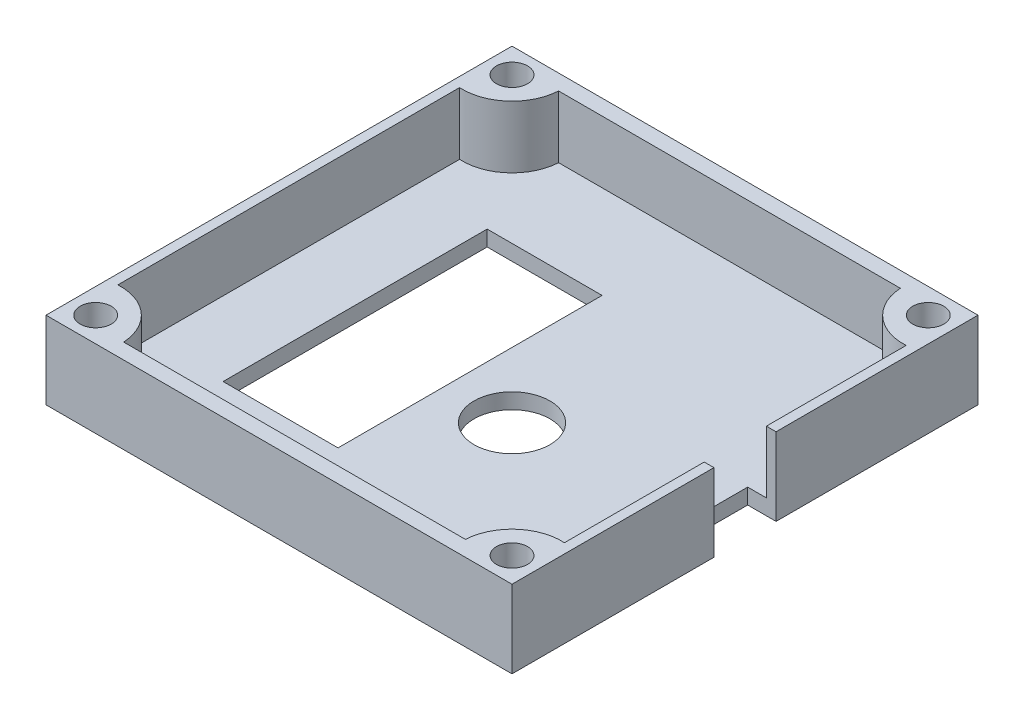
from build123d import *

# Parameters (mm, degrees)
SKETCH1_W           = 38.1
SKETCH1_H           = 38.1
SKETCH1_R           = 1.27
BOSS_EXTRUDE1_DEPTH = 6.35
CUT_EXTRUDE1_DEPTH  = 5.08
CUT_EXTRUDE2_REACH  = 29.679
SKETCH3_W           = 9.398
SKETCH3_H           = 21.59
SKETCH4_W           = 2.320401775
SKETCH4_H           = 5.08
SKETCH4_R           = 3.101894328
CUT_EXTRUDE3_DEPTH  = 28.679008291


with BuildPart() as part:
    # Sketch1 → Boss-Extrude1 (new body)
    with BuildSketch(Plane(origin=(0, 0, 0), x_dir=(1, 0, 0), z_dir=(0, 1, 0))):
        Rectangle(SKETCH1_W, SKETCH1_H)
        with Locations(Location((-17.018, 17.018, 0), (0, 0, 270))):
            Circle(SKETCH1_R, mode=Mode.SUBTRACT)
        with Locations(Location((-17.018, -17.018, 0), (0, 0, 90))):
            Circle(SKETCH1_R, mode=Mode.SUBTRACT)
        with Locations(Location((17.018, -17.018, 0), (0, 0, 270))):
            Circle(SKETCH1_R, mode=Mode.SUBTRACT)
        with Locations(Location((17.018, 17.018, 0), (0, 0, 90))):
            Circle(SKETCH1_R, mode=Mode.SUBTRACT)
    extrude(amount=BOSS_EXTRUDE1_DEPTH)

    # Sketch2 → Cut-Extrude1 (cut)
    with BuildSketch(Plane(origin=(0, 6.35, 0), x_dir=(1, 0, 0), z_dir=(0, 1, 0))):
        with BuildLine():
            Line((18.256262039, 13.97), (18.256262039, -13.97))
            ThreePointArc((18.256262039, -13.97), (15.324054183, -14.987286066), (13.97, -17.78))
            Line((13.97, -17.78), (-13.97, -17.78))
            ThreePointArc((-13.97, -17.78), (-15.324054183, -14.987286066), (-18.256262039, -13.97))
            Line((-18.256262039, -13.97), (-18.256262039, 13.97))
            ThreePointArc((-18.256262039, 13.97), (-15.324054183, 14.987286066), (-13.97, 17.78))
            Line((-13.97, 17.78), (13.97, 17.78))
            ThreePointArc((13.97, 17.78), (15.324054183, 14.987286066), (18.256262039, 13.97))
        make_face()
    extrude(amount=-CUT_EXTRUDE1_DEPTH, mode=Mode.SUBTRACT)

    # Sketch3 → Cut-Extrude2 (cut, up to next)
    with BuildSketch(Plane.XZ, mode=Mode.PRIVATE) as cut_extrude2_sk1:
        with Locations((-7.493, 0.635)):
            Rectangle(SKETCH3_W, SKETCH3_H)
    cut_extrude2_tool1 = extrude(cut_extrude2_sk1.sketch, amount=-CUT_EXTRUDE2_REACH, mode=Mode.PRIVATE) & part.part
    add(cut_extrude2_tool1.solids().sort_by_distance((-7.493, 0, 0.635))[0], mode=Mode.SUBTRACT)

    # Sketch4 → Cut-Extrude3 (cut, through all)
    with BuildSketch(Plane.XZ):
        with Locations((20.210200888, 0)):
            Rectangle(SKETCH4_W, SKETCH4_H)
        with Locations((17.889799113, 0)):
            Rectangle(SKETCH4_W, SKETCH4_H)
        with Locations(Location((2.54, 2.54, 0), (0, 0, 270))):
            Circle(SKETCH4_R)
    extrude(amount=-CUT_EXTRUDE3_DEPTH, mode=Mode.SUBTRACT)


solid = part.part
